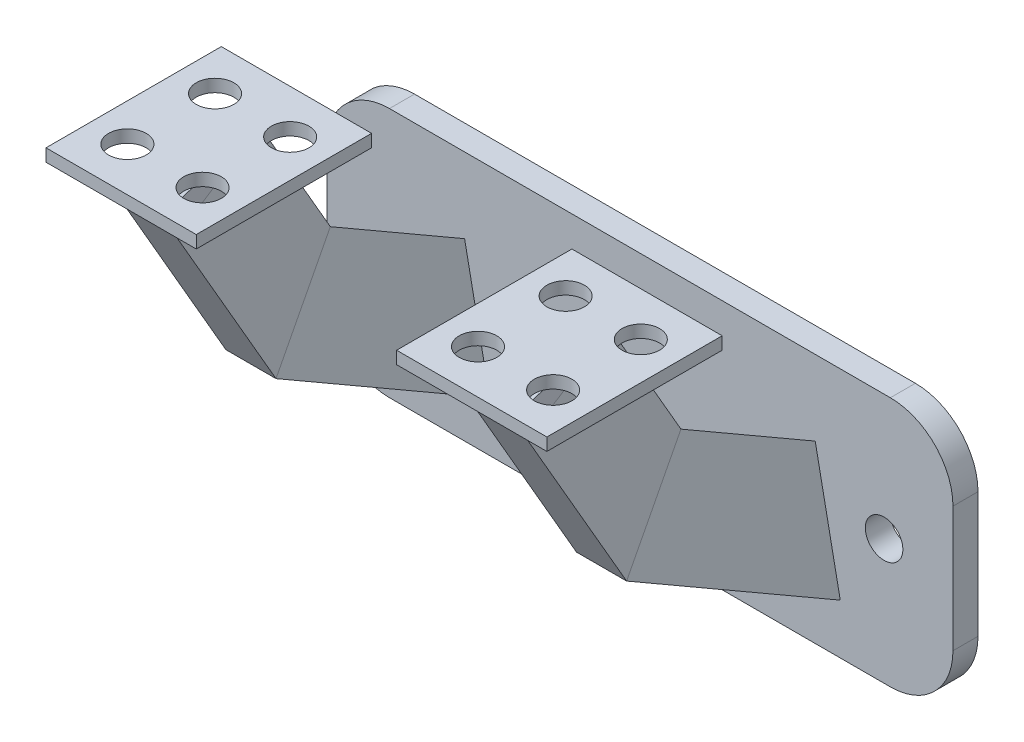
from build123d import *

# Parameters (mm, degrees)
SKETCH_1_W          = 50
SKETCH_1_H          = 20
SKETCH_1_R          = 1.5
EXTRUDE_1_DEPTH     = 2
FILLET_1_R          = 5
SKETCH_7_W          = 4
SKETCH_7_H          = 17.320508076
CUT_EXTRUDE_1_DEPTH = 8
SKETCH_9_W          = 12
SKETCH_9_H          = 14
EXTRUDE_3_DEPTH     = 1
SKETCH_10_R         = 1.5
CUT_EXTRUDE_2_DEPTH = 1


with BuildPart() as part:
    # 草图1 → 凸台-拉伸1 (new body)
    with BuildSketch(Plane.XY):
        Rectangle(SKETCH_1_W, SKETCH_1_H)
        with Locations((-19.5, 0)):
            Circle(SKETCH_1_R, mode=Mode.SUBTRACT)
        with Locations((19.5, 0)):
            Circle(SKETCH_1_R, mode=Mode.SUBTRACT)
    extrude(amount=EXTRUDE_1_DEPTH)

    # 圆角1
    fillet_1_edges = [part.edges().sort_by_distance(p)[0] for p in [
        (25, -10, 1),
        (-25, -10, 1),
        (-25, 10, 1),
        (25, 10, 1),
    ]]
    fillet(fillet_1_edges, radius=FILLET_1_R)

    # 扫描1: sweep along a path in 草图6
    with BuildLine(Plane(origin=(14, 0, 0), x_dir=(0, 0, -1), z_dir=(1, 0, 0))) as sweep_1_path:
        Line((-2, -4.360392195), (-18.021958635, 4.889889936))
        Line((-18.021958635, 4.889889936), (-25.591084209, 18))
        Line((-25.591084209, 18), (-25.591084209, 22))
    # 草图2 → 扫描1 (sweep)
    with BuildSketch(Plane.XY.offset(2)):
        Polygon((14, 4), (12, -6), (16, -6), align=None)
    sweep_1 = sweep(path=sweep_1_path.line, transition=Transition.RIGHT)

    # 草图7 → 切除-拉伸1 (cut)
    with BuildSketch(Plane(origin=(0, 20, 0), x_dir=(1, 0, 0), z_dir=(0, 1, 0))):
        with Locations((14, -18.350772183)):
            Rectangle(SKETCH_7_W, SKETCH_7_H)
    cut_extrude_1 = extrude(amount=CUT_EXTRUDE_1_DEPTH, mode=Mode.SUBTRACT)

    # 草图9 → 凸台-拉伸3 (add)
    with BuildSketch(Plane(origin=(0, 20, 0), x_dir=(1, 0, 0), z_dir=(0, 1, 0))):
        with Locations((14, -22.429425186)):
            Rectangle(SKETCH_9_W, SKETCH_9_H)
    extrude_3 = extrude(amount=EXTRUDE_3_DEPTH)

    # 草图10 → 切除-拉伸2 (cut)
    with BuildSketch(Plane(origin=(0, 21, 0), x_dir=(1, 0, 0), z_dir=(0, 1, 0))):
        with Locations(Location((11, -25.929425186, 0), (0, 0, 270))):
            Circle(SKETCH_10_R)
        with Locations(Location((17, -18.929425186, 0), (0, 0, 270))):
            Circle(SKETCH_10_R)
        with Locations(Location((11, -18.929425186, 0), (0, 0, 270))):
            Circle(SKETCH_10_R)
        with Locations(Location((17, -25.929425186, 0), (0, 0, 270))):
            Circle(SKETCH_10_R)
    cut_extrude_2 = extrude(amount=-CUT_EXTRUDE_2_DEPTH, mode=Mode.SUBTRACT)

    # 镜向1: 扫描1, 切除-拉伸1, 凸台-拉伸3, 切除-拉伸2 across plane
    add(sweep_1.mirror(Plane(origin=(0, 0, 0), x_dir=(0, 0, 1), z_dir=(1, 0, 0))))
    add(cut_extrude_1.mirror(Plane(origin=(0, 0, 0), x_dir=(0, 0, 1), z_dir=(1, 0, 0))), mode=Mode.SUBTRACT)
    add(extrude_3.mirror(Plane(origin=(0, 0, 0), x_dir=(0, 0, 1), z_dir=(1, 0, 0))))
    add(cut_extrude_2.mirror(Plane(origin=(0, 0, 0), x_dir=(0, 0, 1), z_dir=(1, 0, 0))), mode=Mode.SUBTRACT)


solid = part.part
